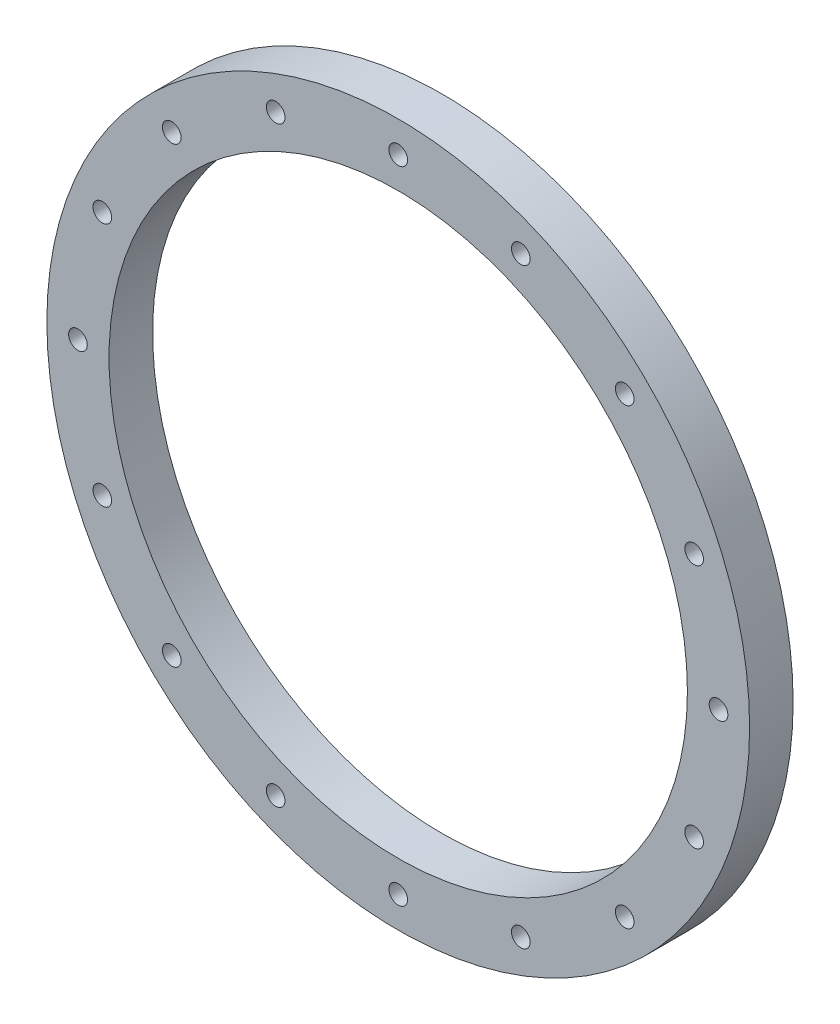
from build123d import *

# Parameters (mm, degrees)
SKETCH1_R               = 564.965
SKETCH1_R_2             = 464.965
BOSS_EXTRUDE1_DEPTH     = 70
CUT_EXTRUDE2_DEPTH      = 803.041708672
CUT_EXTRUDE2_DEPTH_BACK = 803.041708672
SKETCH3_R               = 15


with BuildPart() as part:
    # Sketch1 → Boss-Extrude1 (new body)
    with BuildSketch(Plane.XY):
        Circle(SKETCH1_R)
        Circle(SKETCH1_R_2, mode=Mode.SUBTRACT)
    extrude(amount=BOSS_EXTRUDE1_DEPTH)

    # Sketch3 → Cut-Extrude2 (cut, two sides: drawn at the far end of the back side and taken through both)
    with BuildSketch(Plane.XY.offset(70).offset(-CUT_EXTRUDE2_DEPTH_BACK)):
        with Locations((197.068573748, 475.76562346)):
            Circle(SKETCH3_R)
        with Locations((364.135243574, 364.135243574)):
            Circle(SKETCH3_R)
        with Locations((475.76562346, 197.068573748)):
            Circle(SKETCH3_R)
        with Locations((514.965, 0)):
            Circle(SKETCH3_R)
        with Locations((475.76562346, -197.068573748)):
            Circle(SKETCH3_R)
        with Locations((364.135243574, -364.135243574)):
            Circle(SKETCH3_R)
        with Locations((197.068573748, -475.76562346)):
            Circle(SKETCH3_R)
        with Locations((0, -514.965)):
            Circle(SKETCH3_R)
        with Locations((-197.068573748, -475.76562346)):
            Circle(SKETCH3_R)
        with Locations((-364.135243574, -364.135243574)):
            Circle(SKETCH3_R)
        with Locations((-475.76562346, -197.068573748)):
            Circle(SKETCH3_R)
        with Locations((-514.965, 0)):
            Circle(SKETCH3_R)
        with Locations((-475.76562346, 197.068573748)):
            Circle(SKETCH3_R)
        with Locations((-364.135243574, 364.135243574)):
            Circle(SKETCH3_R)
        with Locations((-197.068573748, 475.76562346)):
            Circle(SKETCH3_R)
        with Locations((0, 514.965)):
            Circle(SKETCH3_R)
    extrude(amount=CUT_EXTRUDE2_DEPTH + CUT_EXTRUDE2_DEPTH_BACK, mode=Mode.SUBTRACT)


solid = part.part
